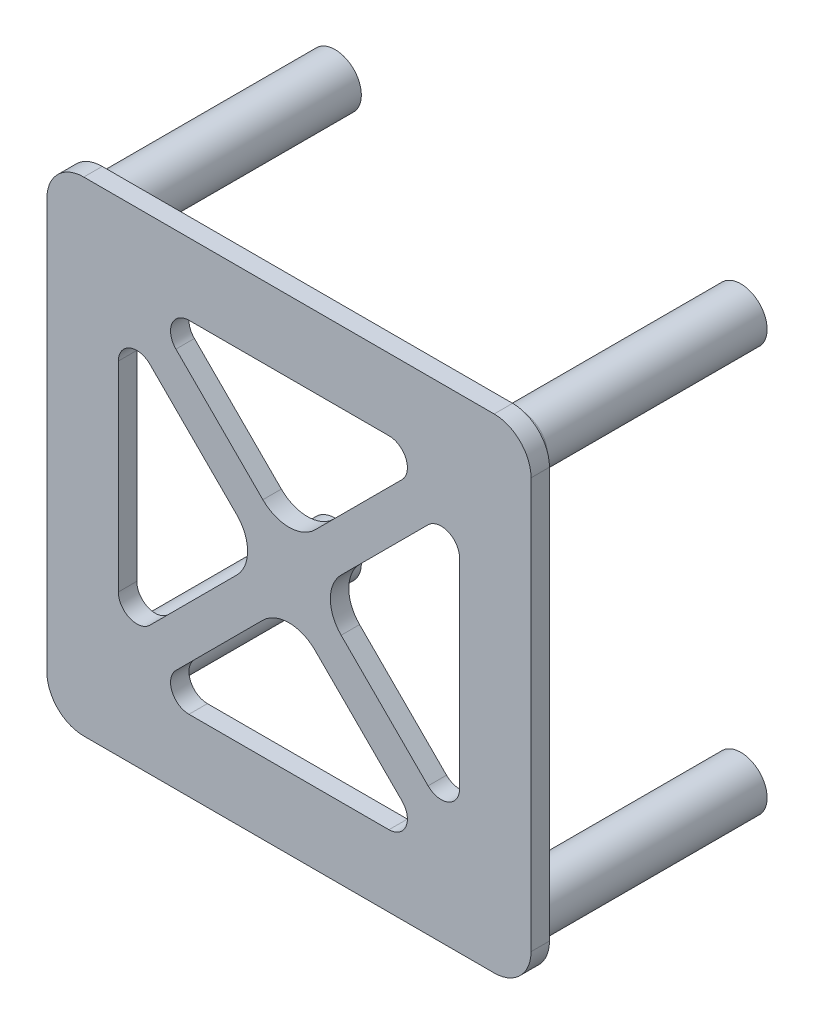
from build123d import *

# Parameters (mm, degrees)
SKETCH1_W           = 52.5
SKETCH1_H           = 52.5
BOSS_EXTRUDE1_DEPTH = 2
SKETCH1_3_R         = 2.85
SKETCH1_3_R_2       = 1.25
BOSS_EXTRUDE2_DEPTH = 25
FILLET1_R           = 4
FILLET2_R           = 1.2
FILLET3_R           = 2
FILLET4_R           = 4


with BuildPart() as part:
    # Sketch1 → Boss-Extrude1 (new body)
    with BuildSketch(Plane.XY):
        with Locations((-13.622062437, -11.00131333)):
            Rectangle(SKETCH1_W, SKETCH1_H)
        Polygon((2.049510438, -29.50131333), (-29.293635312, -29.50131333), (-13.622062437, -13.829740455), align=None, mode=Mode.SUBTRACT)
        Polygon((-32.122062437, -26.672886205), (-32.122062437, 4.670259545), (-16.450489562, -11.00131333), align=None, mode=Mode.SUBTRACT)
        Polygon((-10.793635312, -11.00131333), (4.877937563, 4.670259545), (4.877937563, -26.672886205), align=None, mode=Mode.SUBTRACT)
        Polygon((-13.622062437, -8.172886205), (-29.293635312, 7.49868667), (2.049510438, 7.49868667), align=None, mode=Mode.SUBTRACT)
    extrude(amount=BOSS_EXTRUDE1_DEPTH)

    # Sketch1<3> → Boss-Extrude2 (add)
    # profile 1 of 4: a face of its own
    with BuildSketch(Plane.XY):
        with Locations((-35.622062437, 10.99868667)):
            Circle(SKETCH1_3_R)
        with Locations((-35.622062437, 10.99868667)):
            Circle(SKETCH1_3_R_2, mode=Mode.SUBTRACT)
    # profile 2 of 4: a face of its own
    with BuildSketch(Plane.XY):
        with Locations((8.377937563, 10.99868667)):
            Circle(SKETCH1_3_R)
        with Locations((8.377937563, 10.99868667)):
            Circle(SKETCH1_3_R_2, mode=Mode.SUBTRACT)
    # profile 3 of 4: a face of its own
    with BuildSketch(Plane.XY):
        with Locations((-35.622062437, -33.00131333)):
            Circle(SKETCH1_3_R)
        with Locations((-35.622062437, -33.00131333)):
            Circle(SKETCH1_3_R_2, mode=Mode.SUBTRACT)
    # profile 4 of 4: a face of its own
    with BuildSketch(Plane.XY):
        with Locations((8.377937563, -33.00131333)):
            Circle(SKETCH1_3_R)
        with Locations((8.377937563, -33.00131333)):
            Circle(SKETCH1_3_R_2, mode=Mode.SUBTRACT)
    extrude(amount=-BOSS_EXTRUDE2_DEPTH)

    # Fillet1
    fillet1_edges = [part.edges().sort_by_distance(p)[0] for p in [
        (-39.872062437, 15.24868667, 1),
        (12.627937563, -37.25131333, 1),
        (12.627937563, 15.24868667, 1),
        (-39.872062437, -37.25131333, 1),
    ]]
    fillet(fillet1_edges, radius=FILLET1_R)

    # Fillet2
    fillet2_edges = [part.edges().sort_by_distance(p)[0] for p in [
        (5.527937563, -33.00131333, 0),
        (-38.472062437, -33.00131333, 0),
        (-38.472062437, 10.99868667, 0),
        (5.527937563, 10.99868667, 0),
    ]]
    fillet(fillet2_edges, radius=FILLET2_R)

    # Fillet3
    fillet3_edges = [part.edges().sort_by_distance(p)[0] for p in [
        (-29.293635312, 7.49868667, 1),
        (2.049510438, 7.49868667, 1),
        (4.877937563, 4.670259545, 1),
        (4.877937563, -26.672886205, 1),
        (2.049510438, -29.50131333, 1),
        (-29.293635312, -29.50131333, 1),
        (-32.122062437, -26.672886205, 1),
        (-32.122062437, 4.670259545, 1),
    ]]
    fillet(fillet3_edges, radius=FILLET3_R)

    # Fillet4
    fillet4_edges = [part.edges().sort_by_distance(p)[0] for p in [
        (-13.622062437, -8.172886205, 1),
        (-16.450489562, -11.00131333, 1),
        (-13.622062437, -13.829740455, 1),
        (-10.793635312, -11.00131333, 1),
    ]]
    fillet(fillet4_edges, radius=FILLET4_R)


solid = part.part
